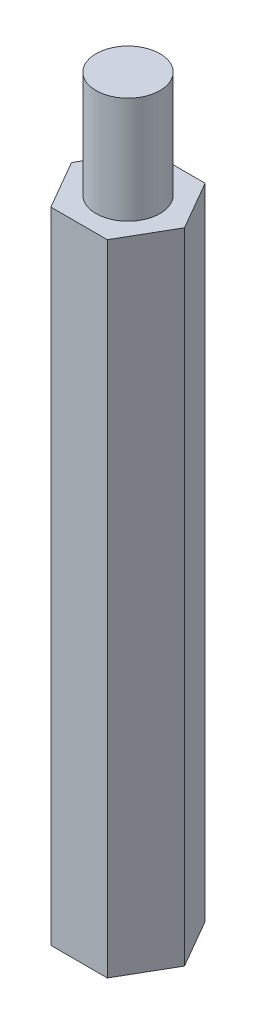
from build123d import *

# Parameters (mm, degrees)
BOSS_EXTRUDE1_DEPTH = 30
SKETCH2_R           = 1.6
CUT_EXTRUDE1_DEPTH  = 5
SKETCH3_R           = 1.5
BOSS_EXTRUDE3_DEPTH = 5


with BuildPart() as part:
    # Sketch1 → Boss-Extrude1 (new body)
    with BuildSketch(Plane(origin=(0, 0, 0), x_dir=(1, 0, 0), z_dir=(0, 1, 0))):
        Polygon((2.65, 0), (1.325, 2.29496732), (-1.325, 2.29496732), (-2.65, 0), (-1.325, -2.29496732), (1.325, -2.29496732), align=None)
    extrude(amount=BOSS_EXTRUDE1_DEPTH)

    # Sketch2 → Cut-Extrude1 (cut)
    with BuildSketch(Plane.XZ):
        with Locations(Location((0, 0, 0), (0, 0, 270))):
            Circle(SKETCH2_R)
    extrude(amount=-CUT_EXTRUDE1_DEPTH, mode=Mode.SUBTRACT)

    # Sketch3 → Boss-Extrude3 (add)
    with BuildSketch(Plane(origin=(0, 30, 0), x_dir=(1, 0, 0), z_dir=(0, 1, 0))):
        with Locations(Location((0, 0, 0), (0, 0, 270))):
            Circle(SKETCH3_R)
    extrude(amount=BOSS_EXTRUDE3_DEPTH)


solid = part.part
